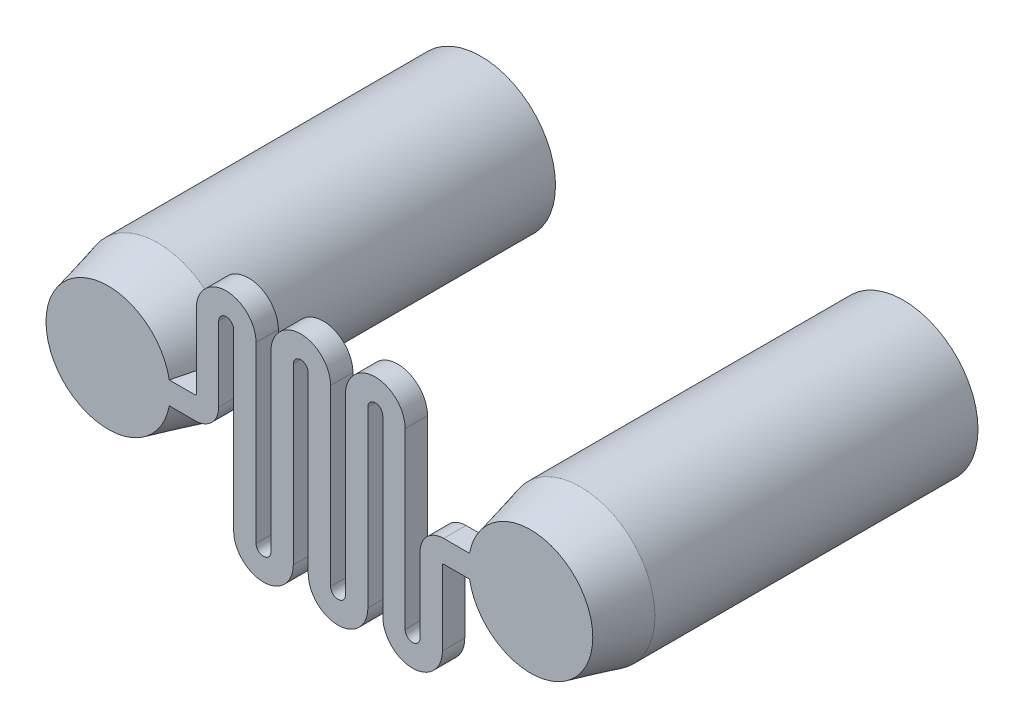
from build123d import *

# Parameters (mm, degrees)
BOSS_EXTRUDE1_DEPTH = 1.8
SKETCH5_R           = 5
CUT_EXTRUDE1_DEPTH  = 28


with BuildPart() as part:
    # Sketch2 → Boss-Extrude1 (new body)
    with BuildSketch(Plane.XY):
        with BuildLine():
            Line((-20.5, -0.9), (-13.5, -0.9))
            ThreePointArc((-13.5, -0.9), (-12.156497116, -0.343502884), (-11.6, 1))
            Line((-11.6, 1), (-11.6, 7))
            ThreePointArc((-11.6, 7), (-11, 7.6), (-10.4, 7))
            Line((-10.4, 7), (-10.4, 0))
            Line((-10.4, 0), (-10.4, -7))
            ThreePointArc((-10.4, -7), (-8, -9.4), (-5.6, -7))
            Line((-5.6, -7), (-5.6, 0))
            Line((-5.6, 0), (-5.6, 7))
            ThreePointArc((-5.6, 7), (-5, 7.6), (-4.4, 7))
            Line((-4.4, 7), (-4.4, 0))
            Line((-4.4, 0), (-4.4, -7))
            ThreePointArc((-4.4, -7), (-2, -9.4), (0.4, -7))
            Line((0.4, -7), (0.4, 0))
            Line((0.4, 0), (0.4, 7))
            ThreePointArc((0.4, 7), (1, 7.6), (1.6, 7))
            Line((1.6, 7), (1.6, 0))
            Line((1.6, 0), (1.6, -7))
            ThreePointArc((1.6, -7), (4, -9.4), (6.4, -7))
            Line((6.4, -7), (6.4, -1))
            ThreePointArc((6.4, -1), (6.429289322, -0.929289322), (6.5, -0.9))
            Line((6.5, -0.9), (13.5, -0.9))
            ThreePointArc((13.5, -0.9), (14.4, 0), (13.5, 0.9))
            Line((13.5, 0.9), (6.5, 0.9))
            ThreePointArc((6.5, 0.9), (5.156497116, 0.343502884), (4.6, -1))
            Line((4.6, -1), (4.6, -7))
            ThreePointArc((4.6, -7), (4, -7.6), (3.4, -7))
            Line((3.4, -7), (3.4, 0))
            Line((3.4, 0), (3.4, 7))
            ThreePointArc((3.4, 7), (1, 9.4), (-1.4, 7))
            Line((-1.4, 7), (-1.4, 0))
            Line((-1.4, 0), (-1.4, -7))
            ThreePointArc((-1.4, -7), (-2, -7.6), (-2.6, -7))
            Line((-2.6, -7), (-2.6, 0))
            Line((-2.6, 0), (-2.6, 7))
            ThreePointArc((-2.6, 7), (-5, 9.4), (-7.4, 7))
            Line((-7.4, 7), (-7.4, 0))
            Line((-7.4, 0), (-7.4, -7))
            ThreePointArc((-7.4, -7), (-8, -7.6), (-8.6, -7))
            Line((-8.6, -7), (-8.6, 0))
            Line((-8.6, 0), (-8.6, 7))
            ThreePointArc((-8.6, 7), (-11, 9.4), (-13.4, 7))
            Line((-13.4, 7), (-13.4, 1))
            ThreePointArc((-13.4, 1), (-13.429289322, 0.929289322), (-13.5, 0.9))
            Line((-13.5, 0.9), (-20.5, 0.9))
            ThreePointArc((-20.5, 0.9), (-21.4, 0), (-20.5, -0.9))
        make_face()
    extrude(amount=BOSS_EXTRUDE1_DEPTH)

    # Sketch3 → Revolve1 (revolve)
    with BuildSketch(Plane(origin=(0, 0, 0), x_dir=(1, 0, 0), z_dir=(0, 1, 0)), mode=Mode.PRIVATE) as revolve1_sk:
        Polygon((-20.5, -1.8), (-25.5, -1.8), (-26.5, 2.2), (-26.5, 28.2), (-20.5, 28.2), align=None)
    revolve(revolve1_sk.sketch.rotate(Axis((-20.5, 0, 1.8), (0, 0, -1)), 190.369760083), axis=Axis((-20.5, 0, 1.8), (0, 0, -1)))

    # Sketch4 → Revolve2 (revolve)
    with BuildSketch(Plane(origin=(0, 0, 0), x_dir=(1, 0, 0), z_dir=(0, 1, 0)), mode=Mode.PRIVATE) as revolve2_sk:
        Polygon((13.5, -1.8), (18.5, -1.8), (19.5, 2.2), (19.5, 28.2), (13.5, 28.2), align=None)
    revolve(revolve2_sk.sketch.rotate(Axis((13.5, 0, 1.8), (0, 0, -1)), 170.494771878), axis=Axis((13.5, 0, 1.8), (0, 0, -1)))

    # Sketch5 → Cut-Extrude1 (cut)
    with BuildSketch(Plane(origin=(0, 0, -28.2), x_dir=(-1, 0, 0), z_dir=(0, 0, -1))):
        with Locations((-13.5, 0)):
            Circle(SKETCH5_R)
        with Locations((20.5, 0)):
            Circle(SKETCH5_R)
    extrude(amount=-CUT_EXTRUDE1_DEPTH, mode=Mode.SUBTRACT)


solid = part.part
